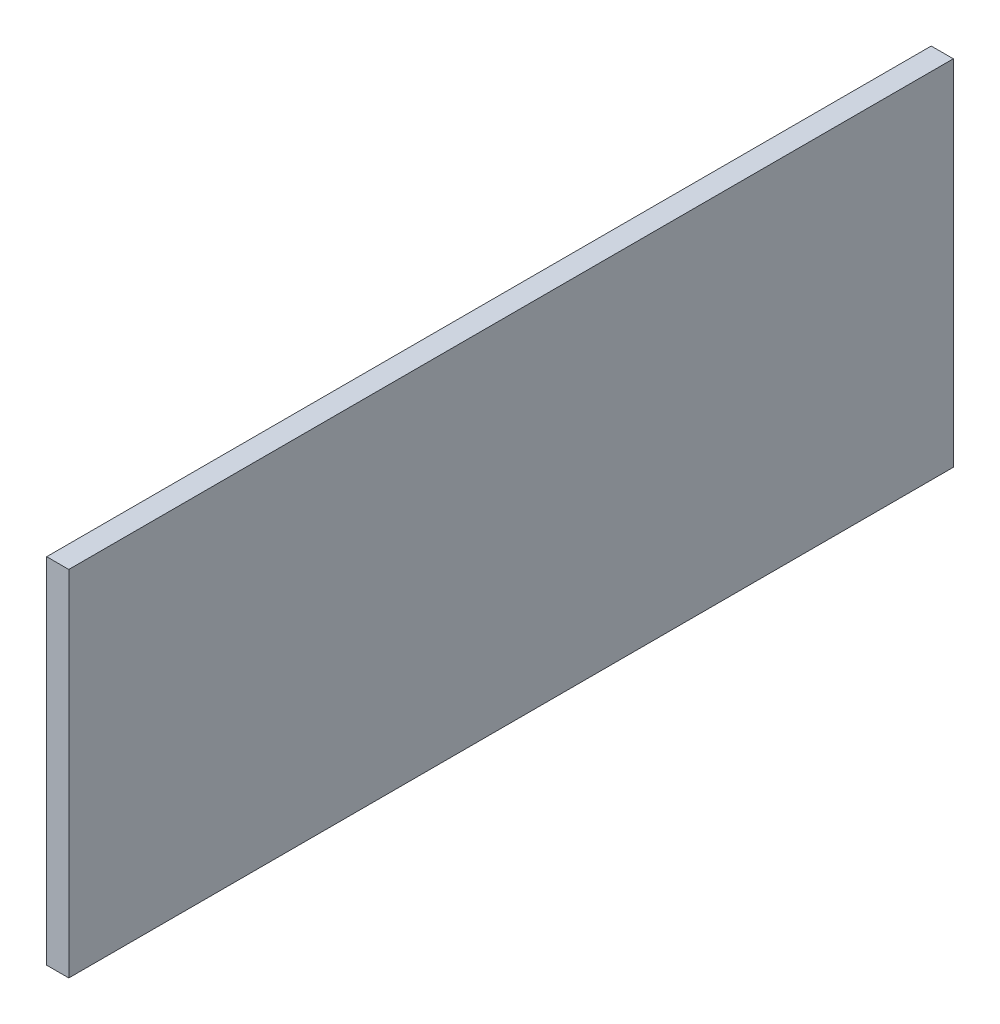
from build123d import *

# Parameters (mm, degrees)
ESQUISSE1_W        = 5
ESQUISSE1_H        = 200
BOSS_EXTRU_1_DEPTH = 80


with BuildPart() as part:
    # Esquisse1 → Boss.-Extru.1 (new body)
    with BuildSketch(Plane(origin=(0, 0, 0), x_dir=(1, 0, 0), z_dir=(0, 1, 0))):
        Rectangle(ESQUISSE1_W, ESQUISSE1_H)
    extrude(amount=BOSS_EXTRU_1_DEPTH)


solid = part.part
